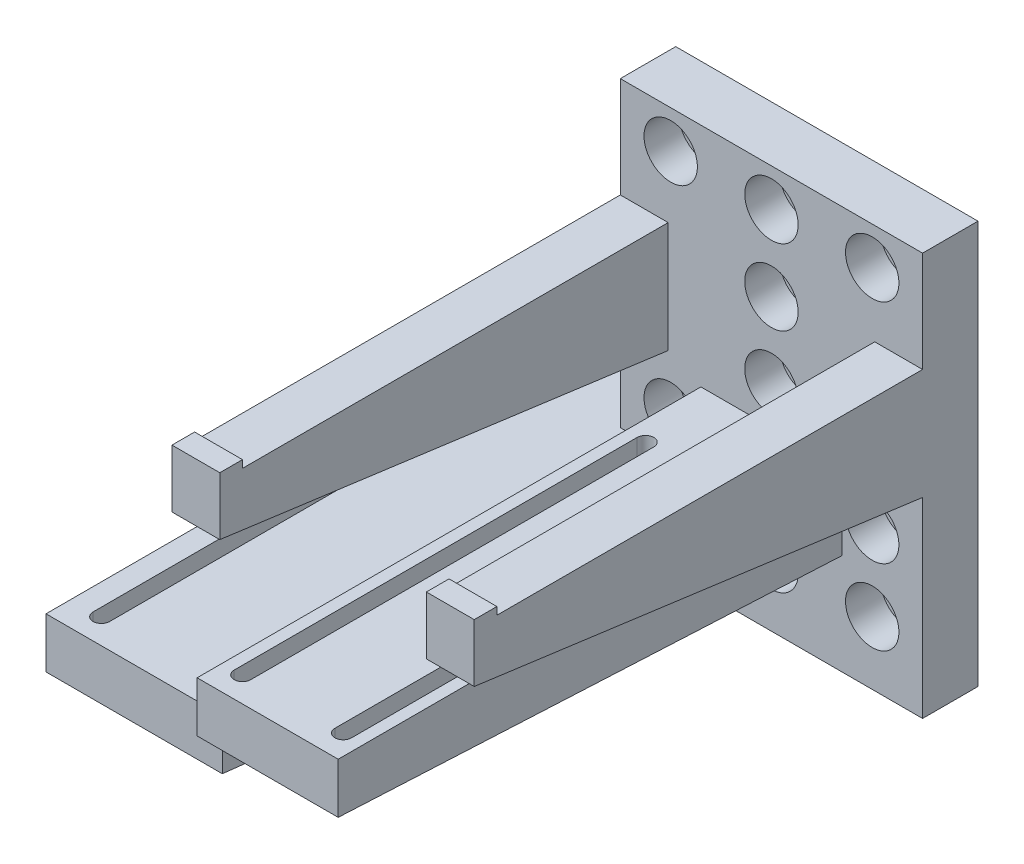
from build123d import *

# Parameters (mm, degrees)
SKETCH1_W                 = 60
SKETCH1_H                 = 80
SKETCH1_R                 = 3.3
BOSS_EXTRUDE1_DEPTH       = 4
SKETCH3_W                 = 60
SKETCH3_H                 = 80
SKETCH3_R                 = 5.3
BOSS_EXTRUDE2_DEPTH       = 7
SKETCH4_W                 = 9.5
SKETCH4_H                 = 10
BOSS_EXTRUDE3_DEPTH       = 89
BOSS_EXTRUDE4_DEPTH       = 9.5
BOSS_EXTRUDE5_DEPTH       = 9.5
SKETCH7_W                 = 9.5
SKETCH7_H                 = 4.5
BOSS_EXTRUDE6_DEPTH       = 1.5
SKETCH9_W                 = 28
SKETCH9_H                 = 10
BOSS_EXTRUDE7_DEPTH       = 100
BOSS_EXTRUDE9_DEPTH       = 28
CUT_EXTRUDE1_DEPTH        = 18
BOSS_EXTRUDE10_DEPTH      = 25
BOSS_EXTRUDE10_DEPTH_BACK = 10
SKETCH13_W                = 100
SKETCH13_H                = 10
SKETCH14_W                = 11
SKETCH14_H                = 20
BOSS_EXTRUDE11_DEPTH      = 25
CUT_EXTRUDE2_DEPTH        = 10
BOSS_EXTRUDE12_DEPTH      = 15


with BuildPart() as part:
    # Sketch1 → Boss-Extrude1 (new body)
    with BuildSketch(Plane.XY):
        Rectangle(SKETCH1_W, SKETCH1_H)
        with Locations((-20, -12.5)):
            Circle(SKETCH1_R, mode=Mode.SUBTRACT)
        with Locations((20, -12.5)):
            Circle(SKETCH1_R, mode=Mode.SUBTRACT)
        with Locations((0, 17.5)):
            Circle(SKETCH1_R, mode=Mode.SUBTRACT)
        with Locations((0, 2.5)):
            Circle(SKETCH1_R, mode=Mode.SUBTRACT)
        with Locations((20, 32.5)):
            Circle(SKETCH1_R, mode=Mode.SUBTRACT)
        with Locations((0, 32.5)):
            Circle(SKETCH1_R, mode=Mode.SUBTRACT)
        with Locations((-20, 32.5)):
            Circle(SKETCH1_R, mode=Mode.SUBTRACT)
        with Locations((0, -27.5)):
            Circle(SKETCH1_R, mode=Mode.SUBTRACT)
        with Locations((20, -27.5)):
            Circle(SKETCH1_R, mode=Mode.SUBTRACT)
    extrude(amount=-BOSS_EXTRUDE1_DEPTH)

    # Sketch3 → Boss-Extrude2 (add)
    with BuildSketch(Plane.XY):
        Rectangle(SKETCH3_W, SKETCH3_H)
        with Locations((0, 17.5)):
            Circle(SKETCH3_R, mode=Mode.SUBTRACT)
        with Locations((-20, -12.5)):
            Circle(SKETCH3_R, mode=Mode.SUBTRACT)
        with Locations((20, -12.5)):
            Circle(SKETCH3_R, mode=Mode.SUBTRACT)
        with Locations((0, 2.5)):
            Circle(SKETCH3_R, mode=Mode.SUBTRACT)
        with Locations((-20, 32.5)):
            Circle(SKETCH3_R, mode=Mode.SUBTRACT)
        with Locations((0, 32.5)):
            Circle(SKETCH3_R, mode=Mode.SUBTRACT)
        with Locations((20, 32.5)):
            Circle(SKETCH3_R, mode=Mode.SUBTRACT)
        with Locations((0, -27.5)):
            Circle(SKETCH3_R, mode=Mode.SUBTRACT)
        with Locations((20, -27.5)):
            Circle(SKETCH3_R, mode=Mode.SUBTRACT)
    extrude(amount=BOSS_EXTRUDE2_DEPTH)

    # Sketch4 → Boss-Extrude3 (add)
    with BuildSketch(Plane.XY.offset(7)):
        with Locations((-25.25, 15)):
            Rectangle(SKETCH4_W, SKETCH4_H)
        with Locations((25.25, 15)):
            Rectangle(SKETCH4_W, SKETCH4_H)
    extrude(amount=BOSS_EXTRUDE3_DEPTH)

    # Sketch5 → Boss-Extrude4 (add)
    with BuildSketch(Plane(origin=(30, 0, 0), x_dir=(0, 0, -1), z_dir=(1, 0, 0))):
        Polygon((-96, 10), (-7, 10), (-7, -2), align=None)
    extrude(amount=-BOSS_EXTRUDE4_DEPTH)

    # Sketch6 → Boss-Extrude5 (add)
    with BuildSketch(Plane.ZY.offset(30)):
        Polygon((96, 10), (7, 10), (7, -2), align=None)
    extrude(amount=-BOSS_EXTRUDE5_DEPTH)

    # Sketch7 → Boss-Extrude6 (add)
    with BuildSketch(Plane(origin=(0, 20, 0), x_dir=(1, 0, 0), z_dir=(0, 1, 0))):
        with Locations((-25.25, -93.75)):
            Rectangle(SKETCH7_W, SKETCH7_H)
        with Locations((25.25, -93.75)):
            Rectangle(SKETCH7_W, SKETCH7_H)
    extrude(amount=BOSS_EXTRUDE6_DEPTH)

    # Sketch9 → Boss-Extrude7 (add)
    with BuildSketch(Plane.XY.offset(7)):
        with Locations((0, -10)):
            Rectangle(SKETCH9_W, SKETCH9_H)
    extrude(amount=BOSS_EXTRUDE7_DEPTH)

    # Sketch11 → Boss-Extrude9 (add)
    with BuildSketch(Plane.ZY.offset(14)):
        Polygon((107, -15), (7, -15), (7, -20), align=None)
    extrude(amount=-BOSS_EXTRUDE9_DEPTH)

    # Sketch12 → Cut-Extrude1 (cut)
    with BuildSketch(Plane(origin=(0, -5, 0), x_dir=(1, 0, 0), z_dir=(0, 1, 0))):
        with BuildLine():
            Line((-11.65, -22), (-11.65, -102))
            ThreePointArc((-11.65, -102), (-10, -103.65), (-8.35, -102))
            Line((-8.35, -102), (-8.35, -22))
            ThreePointArc((-8.35, -22), (-10, -20.35), (-11.65, -22))
        make_face()
        with BuildLine():
            Line((8.35, -22), (8.35, -102))
            ThreePointArc((8.35, -102), (10, -103.65), (11.65, -102))
            Line((11.65, -102), (11.65, -22))
            ThreePointArc((11.65, -22), (10, -20.35), (8.35, -22))
        make_face()
    extrude(amount=-CUT_EXTRUDE1_DEPTH, mode=Mode.SUBTRACT)



with BuildPart() as body_2:
    # Sketch13 → Boss-Extrude10 (new, two sides: drawn at the far end of the back side and taken through both)
    with BuildSketch(Plane.ZY.offset(30).offset(-BOSS_EXTRUDE10_DEPTH_BACK)):
        with Locations((46, -25)):
            Rectangle(SKETCH13_W, SKETCH13_H)
    extrude(amount=BOSS_EXTRUDE10_DEPTH + BOSS_EXTRUDE10_DEPTH_BACK)


with BuildPart() as part_1:
    add(part.part)

    add(body_2.part)  # Boss-Extrude11 merges body 2
    # Sketch14 → Boss-Extrude11 (add)
    with BuildSketch(Plane.ZY.offset(30)):
        with Locations((1.5, -30)):
            Rectangle(SKETCH14_W, SKETCH14_H)
    extrude(amount=BOSS_EXTRUDE11_DEPTH)

    # Sketch15 → Cut-Extrude2 (cut)
    with BuildSketch(Plane(origin=(0, -20, 0), x_dir=(1, 0, 0), z_dir=(0, 1, 0))):
        with BuildLine():
            Line((-50.65, -91), (-50.65, -17))
            ThreePointArc((-50.65, -17), (-48.959530594, -15.350496369), (-47.351985179, -17.080914463))
            Line((-47.351985179, -17.080914463), (-47.351985179, -91.080914463))
            ThreePointArc((-47.351985179, -91.080914463), (-49.040469406, -92.649503631), (-50.65, -91))
        make_face()
    extrude(amount=-CUT_EXTRUDE2_DEPTH, mode=Mode.SUBTRACT)

    # Sketch16 → Boss-Extrude12 (add)
    with BuildSketch(Plane(origin=(-20, 0, 0), x_dir=(0, 0, -1), z_dir=(1, 0, 0))):
        Polygon((-96, -30), (-7, -30), (-7, -40), align=None)
    extrude(amount=-BOSS_EXTRUDE12_DEPTH)


solid = part_1.part
